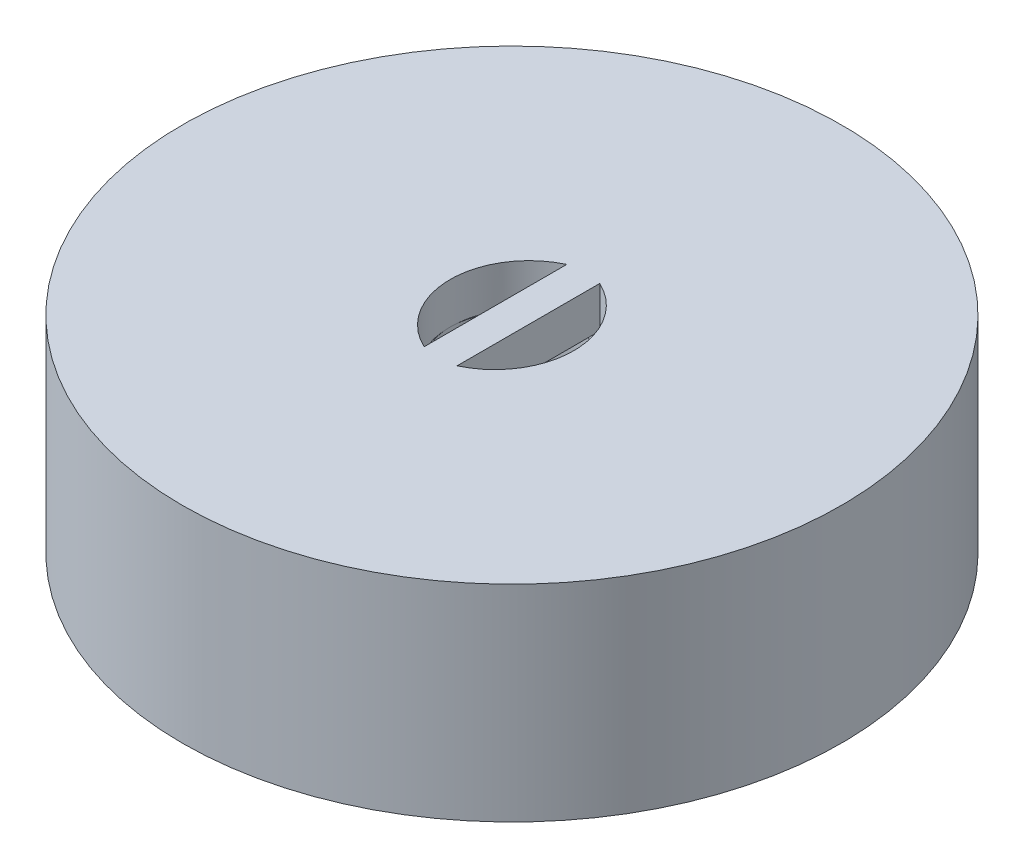
from build123d import *

# Parameters (mm, degrees)
SKETCH1_R           = 1
BOSS_EXTRUDE1_DEPTH = 0.625
CUT_EXTRUDE2_DEPTH  = 0.125
SKETCH3_R           = 0.375
BOSS_EXTRUDE2_DEPTH = 0.375
SKETCH5_R           = 0.1875
CUT_EXTRUDE3_DEPTH  = 0.875
FILLET1_R           = 0.1


with BuildPart() as part:
    # Sketch1 → Boss-Extrude1 (new body)
    with BuildSketch(Plane(origin=(0, 0, 0), x_dir=(1, 0, 0), z_dir=(0, 1, 0))):
        with Locations(Location((0, 0, 0), (0, 0, 270))):
            Circle(SKETCH1_R)
    extrude(amount=BOSS_EXTRUDE1_DEPTH)

    # Sketch2 → Cut-Extrude2 (cut)
    with BuildSketch(Plane(origin=(0, 0.625, 0), x_dir=(1, 0, 0), z_dir=(0, 1, 0))):
        with BuildLine():
            Line((-0.05, 0.216466881), (-0.05, -0.216466881))
            ThreePointArc((-0.05, -0.216466881), (-0.1875, 0), (-0.05, 0.216466881))
        make_face()
        with BuildLine():
            Line((0.05, 0.216466881), (0.05, -0.216466881))
            ThreePointArc((0.05, -0.216466881), (0.1875, 0), (0.05, 0.216466881))
        make_face()
    extrude(amount=-CUT_EXTRUDE2_DEPTH, mode=Mode.SUBTRACT)

    # Sketch3 → Boss-Extrude2 (add)
    with BuildSketch(Plane.XZ):
        with Locations(Location((0, 0, 0), (0, 0, 270))):
            Circle(SKETCH3_R)
    extrude(amount=BOSS_EXTRUDE2_DEPTH)

    # Sketch5 → Cut-Extrude3 (cut)
    with BuildSketch(Plane.XZ.offset(0.375)):
        with Locations(Location((0, 0, 0), (0, 0, 270))):
            Circle(SKETCH5_R)
    extrude(amount=-CUT_EXTRUDE3_DEPTH, mode=Mode.SUBTRACT)

    # Fillet1
    fillet1_edges = [part.edges().sort_by_distance(p)[0] for p in [
        (0, 0, 0.375),
    ]]
    fillet(fillet1_edges, radius=FILLET1_R)


solid = part.part
